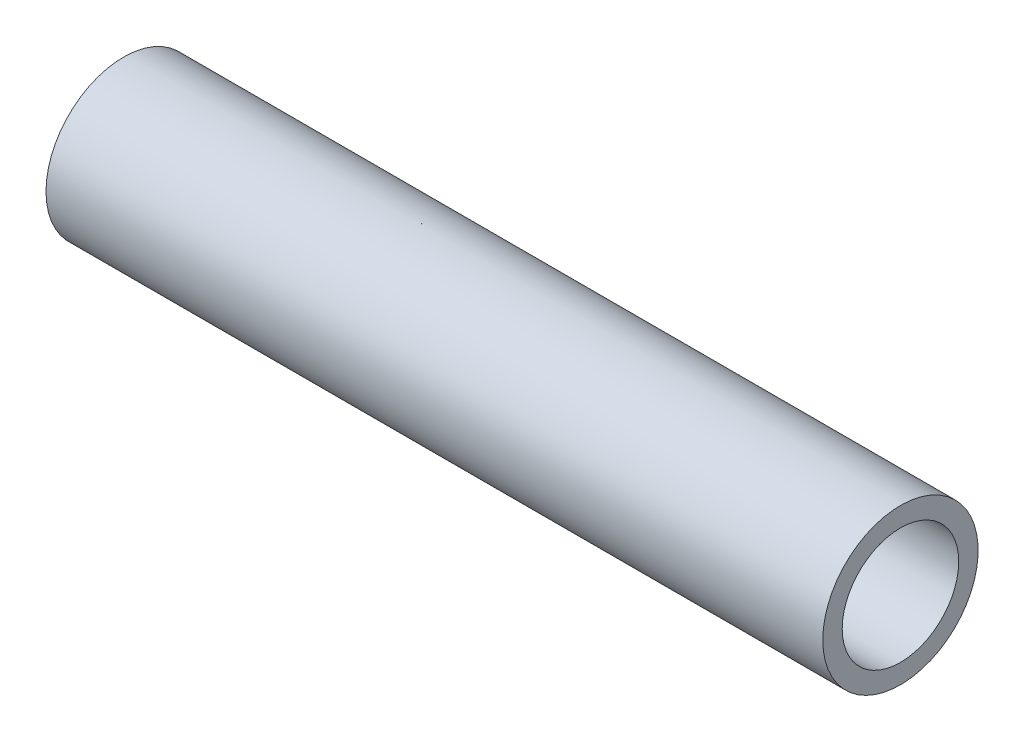
from build123d import *

# Parameters (mm, degrees)
SKETCH1_W = 40
SKETCH1_H = 4


with BuildPart() as part:
    # Sketch1 → Revolve1 (revolve)
    with BuildSketch(Plane.XY, mode=Mode.PRIVATE) as revolve1_sk:
        with Locations((20, 2)):
            Rectangle(SKETCH1_W, SKETCH1_H)
    revolve(revolve1_sk.sketch.rotate(Axis((0, 0, 0), (1, 0, 0)), 90), axis=Axis((0, 0, 0), (1, 0, 0)))

    # SurfaceCut1: cut with a surface, the side it looks to stays
    # Surface-Revolve1: a surface, the sketch's curves turned about an axis
    with BuildLine(Plane.XY, mode=Mode.PRIVATE) as surface_revolve1_1_path:
        Line((0, 3), (40, 3))
    surface_revolve1_1 = Shell.revolve(surface_revolve1_1_path.wire(), 360, Axis((0, 0, 0), (1, 0, 0)))
    split(bisect_by=surface_revolve1_1, keep=Keep.TOP)


solid = part.part
